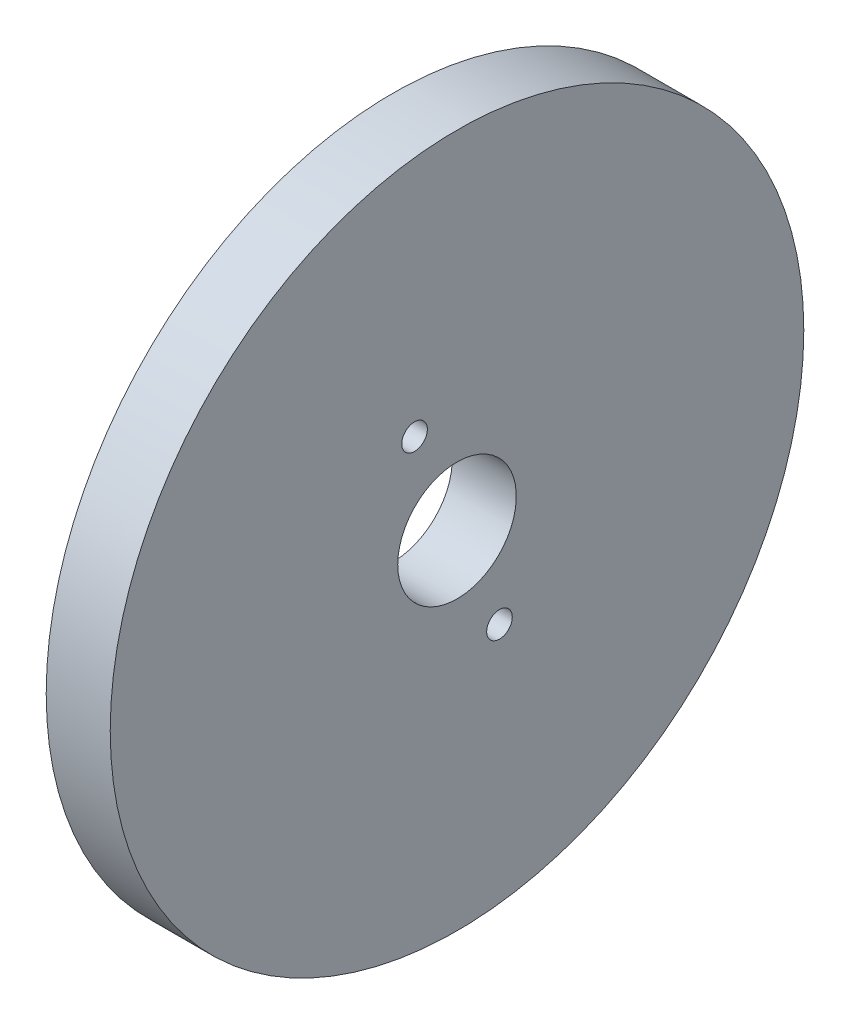
from build123d import *

# Parameters (mm, degrees)
AXIAL_PROFILE_MM_W     = 12
AXIAL_PROFILE_MM_H     = 53.8875
AXIAL_HOLES_DEPTH      = 96.448886845
AXIAL_HOLES_DEPTH_BACK = 96.448886845
SKETCH2_R              = 2.4


with BuildPart() as part:
    # Axial profile (mm) → Full revolution (revolve)
    with BuildSketch(Plane.XY, mode=Mode.PRIVATE) as full_revolution_sk:
        with Locations((19.7, 38.05625)):
            Rectangle(AXIAL_PROFILE_MM_W, AXIAL_PROFILE_MM_H)
    revolve(full_revolution_sk.sketch.rotate(Axis((-110, 0, 0), (1, 0, 0)), 90), axis=Axis((-110, 0, 0), (1, 0, 0)))

    # Sketch2 → Axial holes (cut, two sides: drawn at the far end of the back side and taken through both)
    with BuildSketch(Plane(origin=(0, 0, 0), x_dir=(0, 0, -1), z_dir=(1, 0, 0)).offset(-AXIAL_HOLES_DEPTH_BACK)):
        with Locations((-7.959815393, 19.216694276)):
            Circle(SKETCH2_R)
        with Locations((7.959815393, -19.216694276)):
            Circle(SKETCH2_R)
    extrude(amount=AXIAL_HOLES_DEPTH + AXIAL_HOLES_DEPTH_BACK, mode=Mode.SUBTRACT)


solid = part.part
